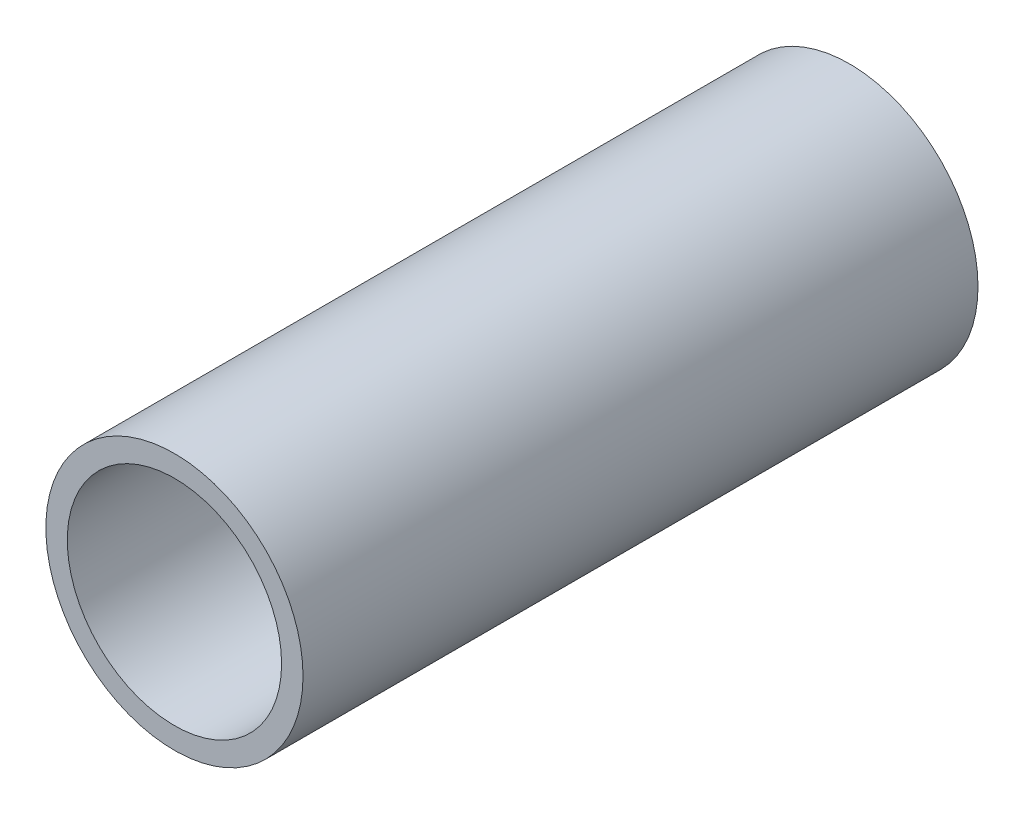
from build123d import *

# Parameters (mm, degrees)
SKETCH1_R           = 19.05
SKETCH1_R_2         = 15.875
EXTRUDE_THIN1_DEPTH = 100


with BuildPart() as part:
    # Sketch1 → Extrude-Thin1 (new body)
    with BuildSketch(Plane.XY):
        Circle(SKETCH1_R)
        Circle(SKETCH1_R_2, mode=Mode.SUBTRACT)
    extrude(amount=-EXTRUDE_THIN1_DEPTH)


solid = part.part
